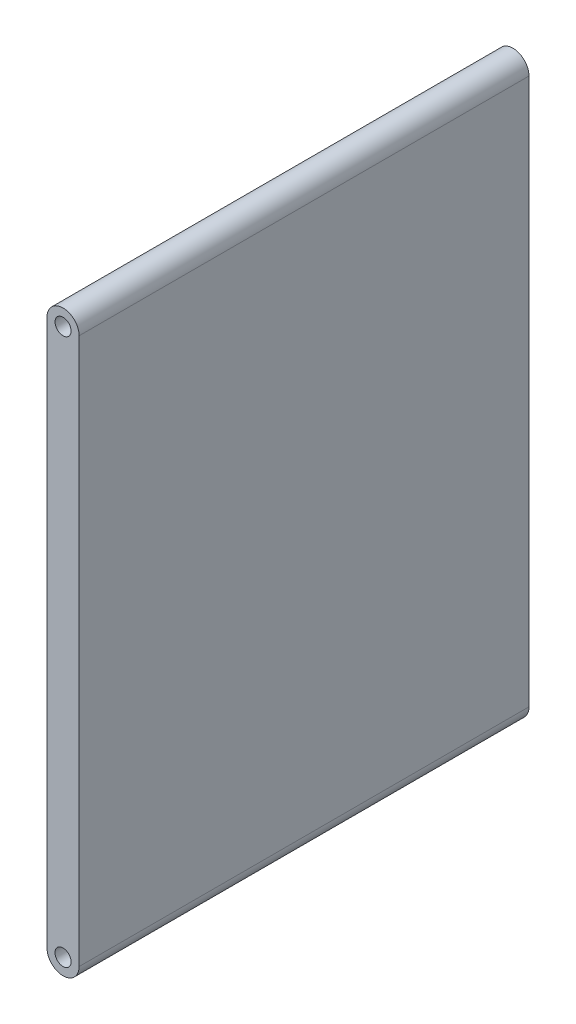
from build123d import *

# Parameters (mm, degrees)
SKETCH_1_R      = 0.5
EXTRUDE_1_DEPTH = 28


with BuildPart() as part:
    # Эскиз1 → Бобышка-Вытянуть1 (new body)
    with BuildSketch(Plane.XY):
        with BuildLine():
            Line((0, 17), (0, -17))
            ThreePointArc((0, -17), (1, -18), (2, -17))
            Line((2, -17), (2, 17))
            ThreePointArc((2, 17), (1, 18), (0, 17))
        make_face()
        with Locations((1, 17)):
            Circle(SKETCH_1_R, mode=Mode.SUBTRACT)
        with Locations(Location((1, -17, 0), (0, 0, 180))):
            Circle(SKETCH_1_R, mode=Mode.SUBTRACT)
    extrude(amount=EXTRUDE_1_DEPTH)


solid = part.part
